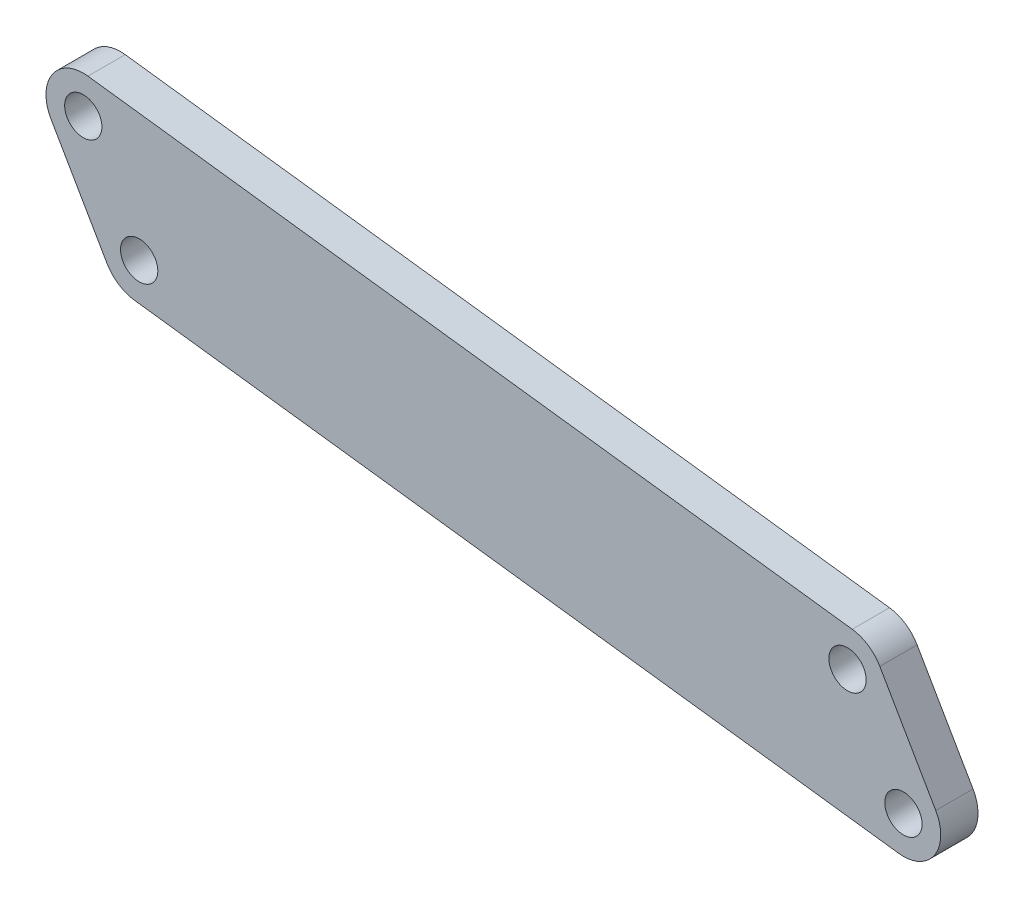
from build123d import *

# Parameters (mm, degrees)
SKETCH2_R           = 1.5
BOSS_EXTRUDE1_DEPTH = 3


with BuildPart() as part:
    # Sketch2 → Boss-Extrude1 (new body)
    with BuildSketch(Plane.XY):
        with BuildLine():
            Line((-61.12281084, 10.770422233), (0.37718916, 2.976193599))
            ThreePointArc((0.37718916, 2.976193599), (1.660673927, 2.49843193), (2.598076211, 1.5))
            Line((2.598076211, 1.5), (7.098076211, -6.294228634))
            ThreePointArc((7.098076211, -6.294228634), (6.99843193, -9.454902562), (4.12281084, -10.770422233))
            Line((4.12281084, -10.770422233), (-57.37718916, -2.976193599))
            ThreePointArc((-57.37718916, -2.976193599), (-58.660673927, -2.49843193), (-59.598076211, -1.5))
            Line((-59.598076211, -1.5), (-64.098076211, 6.294228634))
            ThreePointArc((-64.098076211, 6.294228634), (-63.99843193, 9.454902562), (-61.12281084, 10.770422233))
        make_face()
        with Locations((-57, 0)):
            Circle(SKETCH2_R, mode=Mode.SUBTRACT)
        with Locations((-61.5, 7.794228634)):
            Circle(SKETCH2_R, mode=Mode.SUBTRACT)
        Circle(SKETCH2_R, mode=Mode.SUBTRACT)
        with Locations((4.5, -7.794228634)):
            Circle(SKETCH2_R, mode=Mode.SUBTRACT)
    extrude(amount=BOSS_EXTRUDE1_DEPTH)


solid = part.part
